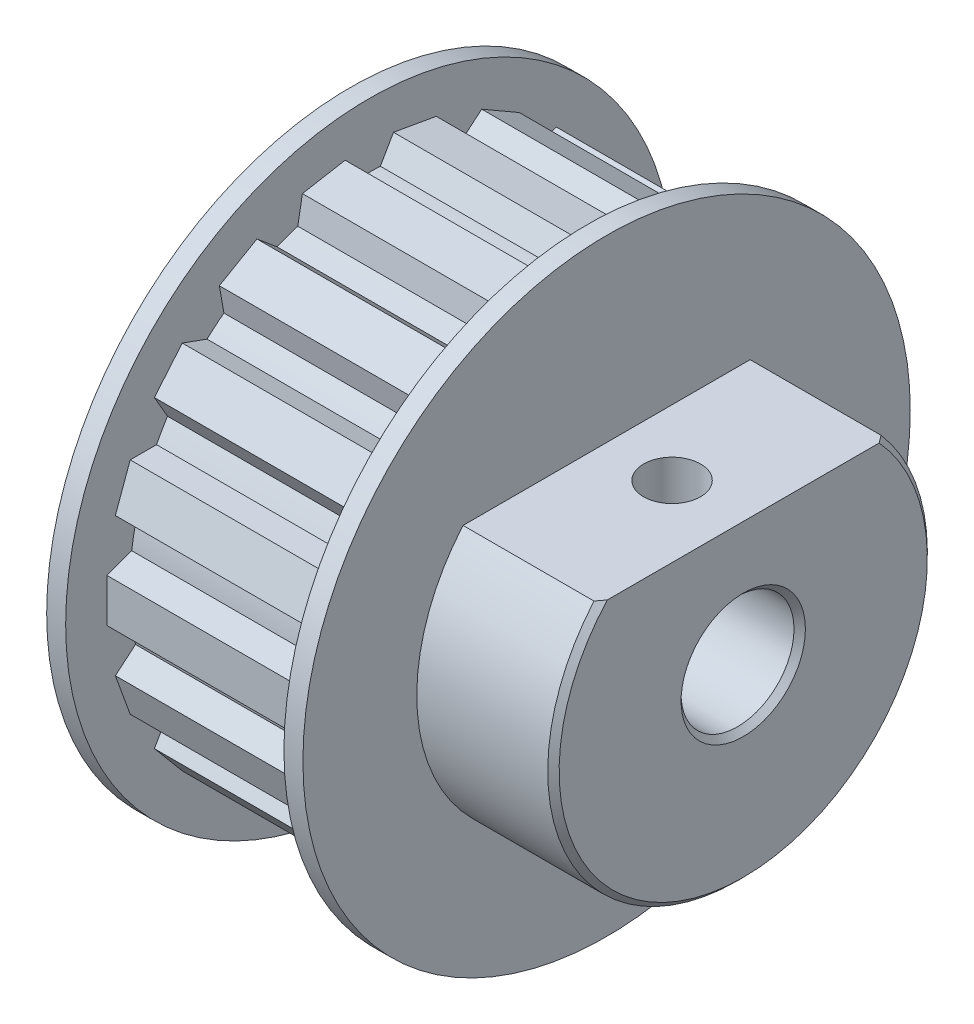
from build123d import *

# Parameters (mm, degrees)
SKETCH2_R                = 10
BOSS_EXTRUDE1_DEPTH      = 7.2
F_6_0_6_DIAMETER_HOLE1_D = 5.95
RIB1_REACH               = 32.667
SKETCH5_WALL_W           = 74.834818822
SKETCH5_WALL_H           = 2.286845356
RIB1_DRAFT_ANGLE         = 20
RIB2_REACH               = 32.667
SKETCH6_WALL_W           = 74.834818822
SKETCH6_WALL_H           = 2.286845356
RIB2_DRAFT_ANGLE         = 20
RIB3_REACH               = 32.667
SKETCH7_WALL_W           = 74.834818822
SKETCH7_WALL_H           = 2.286845356
RIB3_DRAFT_ANGLE         = 20
RIB4_REACH               = 32.667
SKETCH8_WALL_W           = 74.834818822
SKETCH8_WALL_H           = 2.286845356
RIB4_DRAFT_ANGLE         = 20
RIB5_REACH               = 32.667
SKETCH9_WALL_W           = 74.834818822
SKETCH9_WALL_H           = 2.286845356
RIB5_DRAFT_ANGLE         = 20
RIB6_REACH               = 32.667
SKETCH10_WALL_W          = 74.834818822
SKETCH10_WALL_H          = 2.286845356
RIB6_DRAFT_ANGLE         = 20
RIB7_REACH               = 32.667
SKETCH11_WALL_W          = 74.834818822
SKETCH11_WALL_H          = 2.286845356
RIB7_DRAFT_ANGLE         = 20
RIB8_REACH               = 32.667
SKETCH12_WALL_W          = 74.834818822
SKETCH12_WALL_H          = 2.286845356
RIB8_DRAFT_ANGLE         = 20
RIB9_REACH               = 32.667
SKETCH13_WALL_W          = 74.834818822
SKETCH13_WALL_H          = 2.286845356
RIB9_DRAFT_ANGLE         = 20
RIB10_REACH              = 32.667
SKETCH14_WALL_W          = 74.834818822
SKETCH14_WALL_H          = 2.286845356
RIB10_DRAFT_ANGLE        = 20
RIB11_REACH              = 32.667
SKETCH15_WALL_W          = 74.834818822
SKETCH15_WALL_H          = 2.286845356
RIB11_DRAFT_ANGLE        = 20
RIB12_REACH              = 32.667
SKETCH16_WALL_W          = 74.834818822
SKETCH16_WALL_H          = 2.286845356
RIB12_DRAFT_ANGLE        = 20
RIB13_REACH              = 32.667
SKETCH17_WALL_W          = 74.834818822
SKETCH17_WALL_H          = 2.286845356
RIB13_DRAFT_ANGLE        = 20
RIB14_REACH              = 32.667
SKETCH18_WALL_W          = 74.834818822
SKETCH18_WALL_H          = 2.286845356
RIB14_DRAFT_ANGLE        = 20
RIB15_REACH              = 32.667
SKETCH19_WALL_W          = 74.834818822
SKETCH19_WALL_H          = 2.286845356
RIB15_DRAFT_ANGLE        = 20
RIB16_REACH              = 32.667
SKETCH20_WALL_W          = 74.834818822
SKETCH20_WALL_H          = 2.286845356
RIB16_DRAFT_ANGLE        = 20
RIB17_REACH              = 32.667
SKETCH21_WALL_W          = 74.834818822
SKETCH21_WALL_H          = 2.286845356
RIB17_DRAFT_ANGLE        = 20
RIB18_REACH              = 32.667
SKETCH22_WALL_W          = 74.834818822
SKETCH22_WALL_H          = 2.286845356
RIB18_DRAFT_ANGLE        = 20
CHAMFER1_SIZE            = 0.3
SKETCH23_W               = 15.124366872
SKETCH23_H               = 5.378173842
CUT_EXTRUDE2_DEPTH       = 7.2
SKETCH24_R               = 1.5
CUT_EXTRUDE3_DEPTH       = 7.2


with BuildPart() as part:
    # Sketch1 → Revolve1 (revolve)
    with BuildSketch(Plane.XY, mode=Mode.PRIVATE) as revolve1_sk:
        Polygon((0, 16), (0, 0), (13.5, 0), (13.5, 16), (12.5, 16), (12.5, 13.9), (12.5, 12.623944878), (1, 12.623944878), (1, 13.9), (1, 16), align=None)
    revolve(revolve1_sk.sketch.rotate(Axis((0, 0, 0), (1, 0, 0)), 270), axis=Axis((0, 0, 0), (1, 0, 0)))

    # Sketch2 → Boss-Extrude1 (add)
    with BuildSketch(Plane(origin=(13.5, 0, 0), x_dir=(0, 0, -1), z_dir=(1, 0, 0))):
        Circle(SKETCH2_R)
    extrude(amount=BOSS_EXTRUDE1_DEPTH)

    # Ø6.0 (6) Diameter Hole1 (through all)
    with Locations(Plane(origin=(20.7, 0, 0), x_dir=(0, 0, -1), z_dir=(1, 0, 0))):
        with Locations((0, 0)):
            Hole(F_6_0_6_DIAMETER_HOLE1_D / 2)

    # Sketch5 wall → Rib1 (add, up to next)
    with BuildSketch(Plane(origin=(6.9, 0, 13.823944878), x_dir=(-1, 0, 0), z_dir=(0, 0, -1)), mode=Mode.PRIVATE) as rib1_sk1:
        Rectangle(SKETCH5_WALL_W, SKETCH5_WALL_H)
    rib1_tool1 = extrude(rib1_sk1.sketch, amount=RIB1_REACH, mode=Mode.PRIVATE) - part.part
    add(rib1_tool1.solids().sort_by_distance((6.9, 0, 13.823944878))[0])

    # Rib1 draft
    rib1_draft_faces = [part.faces().sort_by_distance(p)[0] for p in [
        (6.9, 1.143422678, 13.323944878),
        (6.9, -1.143422678, 13.323944878),
    ]]
    draft(rib1_draft_faces, Plane(origin=(6.9, 0, 13.823944878), x_dir=(-1, 0, 0), z_dir=(0, 0, 1)), RIB1_DRAFT_ANGLE)

    # Sketch6 wall → Rib2 (add, up to next)
    with BuildSketch(Plane(origin=(6.9, 0, -13.823944878), x_dir=(-1, 0, 0), z_dir=(0, 0, 1)), mode=Mode.PRIVATE) as rib2_sk1:
        Rectangle(SKETCH6_WALL_W, SKETCH6_WALL_H)
    rib2_tool1 = extrude(rib2_sk1.sketch, amount=RIB2_REACH, mode=Mode.PRIVATE) - part.part
    add(rib2_tool1.solids().sort_by_distance((6.9, 0, -13.823944878))[0])

    # Rib2 draft
    rib2_draft_faces = [part.faces().sort_by_distance(p)[0] for p in [
        (6.9, -1.143422678, -13.323944878),
        (6.9, 1.143422678, -13.323944878),
    ]]
    draft(rib2_draft_faces, Plane(origin=(6.9, 0, -13.823944878), x_dir=(-1, 0, 0), z_dir=(0, 0, -1)), RIB2_DRAFT_ANGLE)

    # Sketch7 wall → Rib3 (add, up to next)
    with BuildSketch(Plane(origin=(6.9, -11.971887445, -6.911972439), x_dir=(-1, 0, 0), z_dir=(0, 0.866025403784, 0.5)), mode=Mode.PRIVATE) as rib3_sk1:
        Rectangle(SKETCH7_WALL_W, SKETCH7_WALL_H)
    rib3_tool1 = extrude(rib3_sk1.sketch, amount=RIB3_REACH, mode=Mode.PRIVATE) - part.part
    add(rib3_tool1.solids().sort_by_distance((6.9, -11.971887445, -6.911972439))[0])

    # Rib3 draft
    rib3_draft_faces = [part.faces().sort_by_distance(p)[0] for p in [
        (6.9, -12.110586082, -5.671739353),
        (6.9, -10.967163404, -7.652205525),
    ]]
    draft(rib3_draft_faces, Plane(origin=(6.9, -11.971887445, -6.911972439), x_dir=(-1, 0, 0), z_dir=(0, -0.866025403784, -0.5)), RIB3_DRAFT_ANGLE)

    # Sketch8 wall → Rib4 (add, up to next)
    with BuildSketch(Plane(origin=(6.9, 4.728067609, -12.990258992), x_dir=(-1, 0, 0), z_dir=(0, -0.342020143326, 0.939692620786)), mode=Mode.PRIVATE) as rib4_sk1:
        Rectangle(SKETCH8_WALL_W, SKETCH8_WALL_H)
    rib4_tool1 = extrude(rib4_sk1.sketch, amount=RIB4_REACH, mode=Mode.PRIVATE) - part.part
    add(rib4_tool1.solids().sort_by_distance((6.9, 4.728067609, -12.990258992))[0])

    # Rib4 draft
    rib4_draft_faces = [part.faces().sort_by_distance(p)[0] for p in [
        (6.9, 3.482591685, -12.91148627),
        (6.9, 5.63152339, -12.129339093),
    ]]
    draft(rib4_draft_faces, Plane(origin=(6.9, 4.728067609, -12.990258992), x_dir=(-1, 0, 0), z_dir=(0, 0.342020143326, -0.939692620786)), RIB4_DRAFT_ANGLE)

    # Sketch9 wall → Rib5 (add, up to next)
    with BuildSketch(Plane(origin=(6.9, -4.728067609, 12.990258992), x_dir=(-1, 0, 0), z_dir=(0, 0.342020143326, -0.939692620786)), mode=Mode.PRIVATE) as rib5_sk1:
        Rectangle(SKETCH9_WALL_W, SKETCH9_WALL_H)
    rib5_tool1 = extrude(rib5_sk1.sketch, amount=RIB5_REACH, mode=Mode.PRIVATE) - part.part
    add(rib5_tool1.solids().sort_by_distance((6.9, -4.728067609, 12.990258992))[0])

    # Rib5 draft
    rib5_draft_faces = [part.faces().sort_by_distance(p)[0] for p in [
        (6.9, -3.482591685, 12.91148627),
        (6.9, -5.63152339, 12.129339093),
    ]]
    draft(rib5_draft_faces, Plane(origin=(6.9, -4.728067609, 12.990258992), x_dir=(-1, 0, 0), z_dir=(0, -0.342020143326, 0.939692620786)), RIB5_DRAFT_ANGLE)

    # Sketch10 wall → Rib6 (add, up to next)
    with BuildSketch(Plane(origin=(6.9, -13.613928093, 2.400502836), x_dir=(-1, 0, 0), z_dir=(0, 0.984807753012, -0.173648177667)), mode=Mode.PRIVATE) as rib6_sk1:
        Rectangle(SKETCH10_WALL_W, SKETCH10_WALL_H)
    rib6_tool1 = extrude(rib6_sk1.sketch, amount=RIB6_REACH, mode=Mode.PRIVATE) - part.part
    add(rib6_tool1.solids().sort_by_distance((6.9, -13.613928093, 2.400502836))[0])

    # Rib6 draft
    rib6_draft_faces = [part.faces().sort_by_distance(p)[0] for p in [
        (6.9, -12.922970952, 3.439730265),
        (6.9, -13.320077481, 1.187627229),
    ]]
    draft(rib6_draft_faces, Plane(origin=(6.9, -13.613928093, 2.400502836), x_dir=(-1, 0, 0), z_dir=(0, -0.984807753012, 0.173648177667)), RIB6_DRAFT_ANGLE)

    # Sketch11 wall → Rib7 (add, up to next)
    with BuildSketch(Plane(origin=(6.9, 13.613928093, 2.400502836), x_dir=(-1, 0, 0), z_dir=(0, -0.984807753012, -0.173648177667)), mode=Mode.PRIVATE) as rib7_sk1:
        Rectangle(SKETCH11_WALL_W, SKETCH11_WALL_H)
    rib7_tool1 = extrude(rib7_sk1.sketch, amount=RIB7_REACH, mode=Mode.PRIVATE) - part.part
    add(rib7_tool1.solids().sort_by_distance((6.9, 13.613928093, 2.400502836))[0])

    # Rib7 draft
    rib7_draft_faces = [part.faces().sort_by_distance(p)[0] for p in [
        (6.9, 13.320077481, 1.187627229),
        (6.9, 12.922970952, 3.439730265),
    ]]
    draft(rib7_draft_faces, Plane(origin=(6.9, 13.613928093, 2.400502836), x_dir=(-1, 0, 0), z_dir=(0, 0.984807753012, 0.173648177667)), RIB7_DRAFT_ANGLE)

    # Sketch12 wall → Rib8 (add, up to next)
    with BuildSketch(Plane(origin=(6.9, -13.613928093, -2.400502836), x_dir=(-1, 0, 0), z_dir=(0, 0.984807753012, 0.173648177667)), mode=Mode.PRIVATE) as rib8_sk1:
        Rectangle(SKETCH12_WALL_W, SKETCH12_WALL_H)
    rib8_tool1 = extrude(rib8_sk1.sketch, amount=RIB8_REACH, mode=Mode.PRIVATE) - part.part
    add(rib8_tool1.solids().sort_by_distance((6.9, -13.613928093, -2.400502836))[0])

    # Rib8 draft
    rib8_draft_faces = [part.faces().sort_by_distance(p)[0] for p in [
        (6.9, -13.320077481, -1.187627229),
        (6.9, -12.922970952, -3.439730265),
    ]]
    draft(rib8_draft_faces, Plane(origin=(6.9, -13.613928093, -2.400502836), x_dir=(-1, 0, 0), z_dir=(0, -0.984807753012, -0.173648177667)), RIB8_DRAFT_ANGLE)

    # Sketch13 wall → Rib9 (add, up to next)
    with BuildSketch(Plane(origin=(6.9, 11.971887445, -6.911972439), x_dir=(-1, 0, 0), z_dir=(0, -0.866025403784, 0.5)), mode=Mode.PRIVATE) as rib9_sk1:
        Rectangle(SKETCH13_WALL_W, SKETCH13_WALL_H)
    rib9_tool1 = extrude(rib9_sk1.sketch, amount=RIB9_REACH, mode=Mode.PRIVATE) - part.part
    add(rib9_tool1.solids().sort_by_distance((6.9, 11.971887445, -6.911972439))[0])

    # Rib9 draft
    rib9_draft_faces = [part.faces().sort_by_distance(p)[0] for p in [
        (6.9, 10.967163404, -7.652205525),
        (6.9, 12.110586082, -5.671739353),
    ]]
    draft(rib9_draft_faces, Plane(origin=(6.9, 11.971887445, -6.911972439), x_dir=(-1, 0, 0), z_dir=(0, 0.866025403784, -0.5)), RIB9_DRAFT_ANGLE)

    # Sketch14 wall → Rib10 (add, up to next)
    with BuildSketch(Plane(origin=(6.9, -4.728067609, -12.990258992), x_dir=(-1, 0, 0), z_dir=(0, 0.342020143326, 0.939692620786)), mode=Mode.PRIVATE) as rib10_sk1:
        Rectangle(SKETCH14_WALL_W, SKETCH14_WALL_H)
    rib10_tool1 = extrude(rib10_sk1.sketch, amount=RIB10_REACH, mode=Mode.PRIVATE) - part.part
    add(rib10_tool1.solids().sort_by_distance((6.9, -4.728067609, -12.990258992))[0])

    # Rib10 draft
    rib10_draft_faces = [part.faces().sort_by_distance(p)[0] for p in [
        (6.9, -5.63152339, -12.129339093),
        (6.9, -3.482591685, -12.91148627),
    ]]
    draft(rib10_draft_faces, Plane(origin=(6.9, -4.728067609, -12.990258992), x_dir=(-1, 0, 0), z_dir=(0, -0.342020143326, -0.939692620786)), RIB10_DRAFT_ANGLE)

    # Sketch15 wall → Rib11 (add, up to next)
    with BuildSketch(Plane(origin=(6.9, 13.613928093, -2.400502836), x_dir=(-1, 0, 0), z_dir=(0, -0.984807753012, 0.173648177667)), mode=Mode.PRIVATE) as rib11_sk1:
        Rectangle(SKETCH15_WALL_W, SKETCH15_WALL_H)
    rib11_tool1 = extrude(rib11_sk1.sketch, amount=RIB11_REACH, mode=Mode.PRIVATE) - part.part
    add(rib11_tool1.solids().sort_by_distance((6.9, 13.613928093, -2.400502836))[0])

    # Rib11 draft
    rib11_draft_faces = [part.faces().sort_by_distance(p)[0] for p in [
        (6.9, 12.922970952, -3.439730265),
        (6.9, 13.320077481, -1.187627229),
    ]]
    draft(rib11_draft_faces, Plane(origin=(6.9, 13.613928093, -2.400502836), x_dir=(-1, 0, 0), z_dir=(0, 0.984807753012, -0.173648177667)), RIB11_DRAFT_ANGLE)

    # Sketch16 wall → Rib12 (add, up to next)
    with BuildSketch(Plane(origin=(6.9, -8.885860485, 10.589756156), x_dir=(-1, 0, 0), z_dir=(0, 0.642787609687, -0.766044443119)), mode=Mode.PRIVATE) as rib12_sk1:
        Rectangle(SKETCH16_WALL_W, SKETCH16_WALL_H)
    rib12_tool1 = extrude(rib12_sk1.sketch, amount=RIB12_REACH, mode=Mode.PRIVATE) - part.part
    add(rib12_tool1.solids().sort_by_distance((6.9, -8.885860485, 10.589756156))[0])

    # Rib12 draft
    rib12_draft_faces = [part.faces().sort_by_distance(p)[0] for p in [
        (6.9, -7.688554092, 10.941711864),
        (6.9, -9.440379269, 9.471756004),
    ]]
    draft(rib12_draft_faces, Plane(origin=(6.9, -8.885860485, 10.589756156), x_dir=(-1, 0, 0), z_dir=(0, -0.642787609687, 0.766044443119)), RIB12_DRAFT_ANGLE)

    # Sketch17 wall → Rib13 (add, up to next)
    with BuildSketch(Plane(origin=(6.9, 4.728067609, 12.990258992), x_dir=(-1, 0, 0), z_dir=(0, -0.342020143326, -0.939692620786)), mode=Mode.PRIVATE) as rib13_sk1:
        Rectangle(SKETCH17_WALL_W, SKETCH17_WALL_H)
    rib13_tool1 = extrude(rib13_sk1.sketch, amount=RIB13_REACH, mode=Mode.PRIVATE) - part.part
    add(rib13_tool1.solids().sort_by_distance((6.9, 4.728067609, 12.990258992))[0])

    # Rib13 draft
    rib13_draft_faces = [part.faces().sort_by_distance(p)[0] for p in [
        (6.9, 5.63152339, 12.129339093),
        (6.9, 3.482591685, 12.91148627),
    ]]
    draft(rib13_draft_faces, Plane(origin=(6.9, 4.728067609, 12.990258992), x_dir=(-1, 0, 0), z_dir=(0, 0.342020143326, 0.939692620786)), RIB13_DRAFT_ANGLE)

    # Sketch18 wall → Rib14 (add, up to next)
    with BuildSketch(Plane(origin=(6.9, 8.885860485, 10.589756156), x_dir=(-1, 0, 0), z_dir=(0, -0.642787609687, -0.766044443119)), mode=Mode.PRIVATE) as rib14_sk1:
        Rectangle(SKETCH18_WALL_W, SKETCH18_WALL_H)
    rib14_tool1 = extrude(rib14_sk1.sketch, amount=RIB14_REACH, mode=Mode.PRIVATE) - part.part
    add(rib14_tool1.solids().sort_by_distance((6.9, 8.885860485, 10.589756156))[0])

    # Rib14 draft
    rib14_draft_faces = [part.faces().sort_by_distance(p)[0] for p in [
        (6.9, 9.440379269, 9.471756004),
        (6.9, 7.688554092, 10.941711864),
    ]]
    draft(rib14_draft_faces, Plane(origin=(6.9, 8.885860485, 10.589756156), x_dir=(-1, 0, 0), z_dir=(0, 0.642787609687, 0.766044443119)), RIB14_DRAFT_ANGLE)

    # Sketch19 wall → Rib15 (add, up to next)
    with BuildSketch(Plane(origin=(6.9, -11.971887445, 6.911972439), x_dir=(-1, 0, 0), z_dir=(0, 0.866025403784, -0.5)), mode=Mode.PRIVATE) as rib15_sk1:
        Rectangle(SKETCH19_WALL_W, SKETCH19_WALL_H)
    rib15_tool1 = extrude(rib15_sk1.sketch, amount=RIB15_REACH, mode=Mode.PRIVATE) - part.part
    add(rib15_tool1.solids().sort_by_distance((6.9, -11.971887445, 6.911972439))[0])

    # Rib15 draft
    rib15_draft_faces = [part.faces().sort_by_distance(p)[0] for p in [
        (6.9, -10.967163404, 7.652205525),
        (6.9, -12.110586082, 5.671739353),
    ]]
    draft(rib15_draft_faces, Plane(origin=(6.9, -11.971887445, 6.911972439), x_dir=(-1, 0, 0), z_dir=(0, -0.866025403784, 0.5)), RIB15_DRAFT_ANGLE)

    # Sketch20 wall → Rib16 (add, up to next)
    with BuildSketch(Plane(origin=(6.9, 11.971887445, 6.911972439), x_dir=(-1, 0, 0), z_dir=(0, -0.866025403784, -0.5)), mode=Mode.PRIVATE) as rib16_sk1:
        Rectangle(SKETCH20_WALL_W, SKETCH20_WALL_H)
    rib16_tool1 = extrude(rib16_sk1.sketch, amount=RIB16_REACH, mode=Mode.PRIVATE) - part.part
    add(rib16_tool1.solids().sort_by_distance((6.9, 11.971887445, 6.911972439))[0])

    # Rib16 draft
    rib16_draft_faces = [part.faces().sort_by_distance(p)[0] for p in [
        (6.9, 12.110586082, 5.671739353),
        (6.9, 10.967163404, 7.652205525),
    ]]
    draft(rib16_draft_faces, Plane(origin=(6.9, 11.971887445, 6.911972439), x_dir=(-1, 0, 0), z_dir=(0, 0.866025403784, 0.5)), RIB16_DRAFT_ANGLE)

    # Sketch21 wall → Rib17 (add, up to next)
    with BuildSketch(Plane(origin=(6.9, 8.885860485, -10.589756156), x_dir=(-1, 0, 0), z_dir=(0, -0.642787609687, 0.766044443119)), mode=Mode.PRIVATE) as rib17_sk1:
        Rectangle(SKETCH21_WALL_W, SKETCH21_WALL_H)
    rib17_tool1 = extrude(rib17_sk1.sketch, amount=RIB17_REACH, mode=Mode.PRIVATE) - part.part
    add(rib17_tool1.solids().sort_by_distance((6.9, 8.885860485, -10.589756156))[0])

    # Rib17 draft
    rib17_draft_faces = [part.faces().sort_by_distance(p)[0] for p in [
        (6.9, 7.688554092, -10.941711864),
        (6.9, 9.440379269, -9.471756004),
    ]]
    draft(rib17_draft_faces, Plane(origin=(6.9, 8.885860485, -10.589756156), x_dir=(-1, 0, 0), z_dir=(0, 0.642787609687, -0.766044443119)), RIB17_DRAFT_ANGLE)

    # Sketch22 wall → Rib18 (add, up to next)
    with BuildSketch(Plane(origin=(6.9, -8.885860485, -10.589756156), x_dir=(-1, 0, 0), z_dir=(0, 0.642787609687, 0.766044443119)), mode=Mode.PRIVATE) as rib18_sk1:
        Rectangle(SKETCH22_WALL_W, SKETCH22_WALL_H)
    rib18_tool1 = extrude(rib18_sk1.sketch, amount=RIB18_REACH, mode=Mode.PRIVATE) - part.part
    add(rib18_tool1.solids().sort_by_distance((6.9, -8.885860485, -10.589756156))[0])

    # Rib18 draft
    rib18_draft_faces = [part.faces().sort_by_distance(p)[0] for p in [
        (6.9, -9.440379269, -9.471756004),
        (6.9, -7.688554092, -10.941711864),
    ]]
    draft(rib18_draft_faces, Plane(origin=(6.9, -8.885860485, -10.589756156), x_dir=(-1, 0, 0), z_dir=(0, -0.642787609687, -0.766044443119)), RIB18_DRAFT_ANGLE)

    # Chamfer1
    chamfer1_edges = [part.edges().sort_by_distance(p)[0] for p in [
        (20.7, 0, 10),
        (20.7, 0, -2.975),
        (0, 0, -2.975),
    ]]
    chamfer(chamfer1_edges, length=CHAMFER1_SIZE)

    # Sketch23 → Cut-Extrude2 (cut)
    with BuildSketch(Plane(origin=(20.7, 0, 0), x_dir=(0, 0, -1), z_dir=(1, 0, 0))):
        with Locations((0, 9.232280459)):
            Rectangle(SKETCH23_W, SKETCH23_H)
    extrude(amount=-CUT_EXTRUDE2_DEPTH, mode=Mode.SUBTRACT)

    # Sketch24 → Cut-Extrude3 (cut)
    with BuildSketch(Plane(origin=(0, 6.543193538, 0), x_dir=(1, 0, 0), z_dir=(0, 1, 0))):
        with Locations(Location((16.95, 0, 0), (0, 0, 270))):
            Circle(SKETCH24_R)
    extrude(amount=-CUT_EXTRUDE3_DEPTH, mode=Mode.SUBTRACT)


solid = part.part
